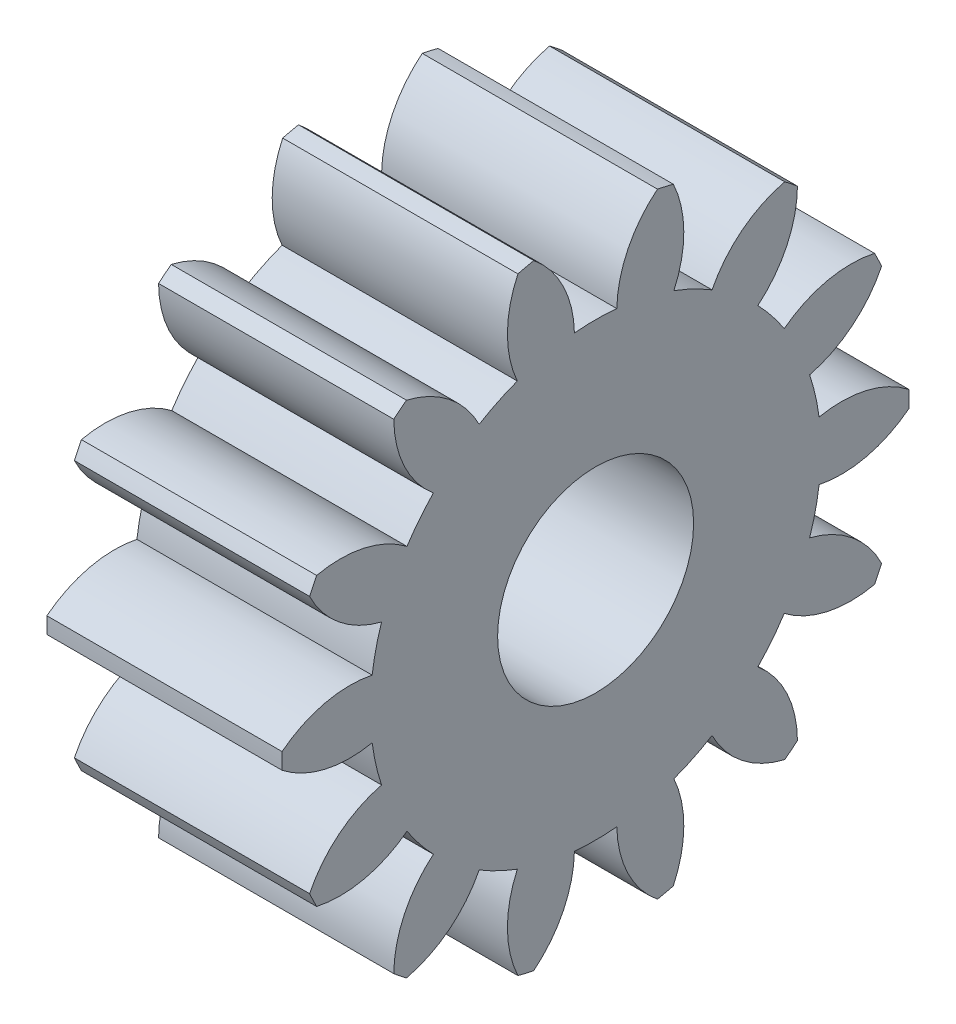
from build123d import *

# Parameters (mm, degrees)
BASPROSKE_W     = 6
BASPROSKE_H     = 8
TOOTHCUT_DEPTH  = 13.806248475
TEETHCUTS_COUNT = 14
TEETHCUTS_ANGLE = 334.285714286
BORSKE_R        = 2.5
BORE_DEPTH      = 10.0000508


with BuildPart() as part:
    # BasProSke → Base-Revolve (revolve)
    with BuildSketch(Plane(origin=(0, 0, 0), x_dir=(1, 0, 0), z_dir=(0, 1, 0)), mode=Mode.PRIVATE) as base_revolve_sk:
        with Locations((3, 4)):
            Rectangle(BASPROSKE_W, BASPROSKE_H)
    revolve(base_revolve_sk.sketch.rotate(Axis((-10, 0, 0), (1, 0, 0)), 180), axis=Axis((-10, 0, 0), (1, 0, 0)))

    # TooCutSke → ToothCut (cut, through all)
    with BuildSketch(Plane(origin=(0, 0, 0), x_dir=(0, 0, -1), z_dir=(1, 0, 0))):
        with BuildLine():
            ThreePointArc((0.540393256, 5.723545765), (0, 5.749), (-0.540393256, 5.723545765))
            ThreePointArc((-0.540393256, 5.723545765), (-0.832220085, 6.912663993), (-1.603550271, 7.863566092))
            ThreePointArc((-1.603550271, 7.863566092), (0, 8.0254), (1.603550271, 7.863566092))
            ThreePointArc((1.603550271, 7.863566092), (0.832220085, 6.912663993), (0.540393256, 5.723545765))
        make_face()
    toothcut = extrude(amount=TOOTHCUT_DEPTH, mode=Mode.SUBTRACT)

    # TeethCuts: ToothCut ×14 about axis
    teethcuts_axis = Axis((-10, 0, 0), (1, 0, 0))
    for i in range(1, TEETHCUTS_COUNT):
        add(toothcut.rotate(teethcuts_axis, i * TEETHCUTS_ANGLE / (TEETHCUTS_COUNT - 1)), mode=Mode.SUBTRACT)

    # BorSke → Bore (cut, symmetric)
    with BuildSketch(Plane(origin=(0, 0, 0), x_dir=(0, 0, -1), z_dir=(1, 0, 0))):
        with Locations(Location((0, 0, 0), (0, 0, 180))):
            Circle(BORSKE_R)
    extrude(amount=BORE_DEPTH, both=True, mode=Mode.SUBTRACT)


solid = part.part
